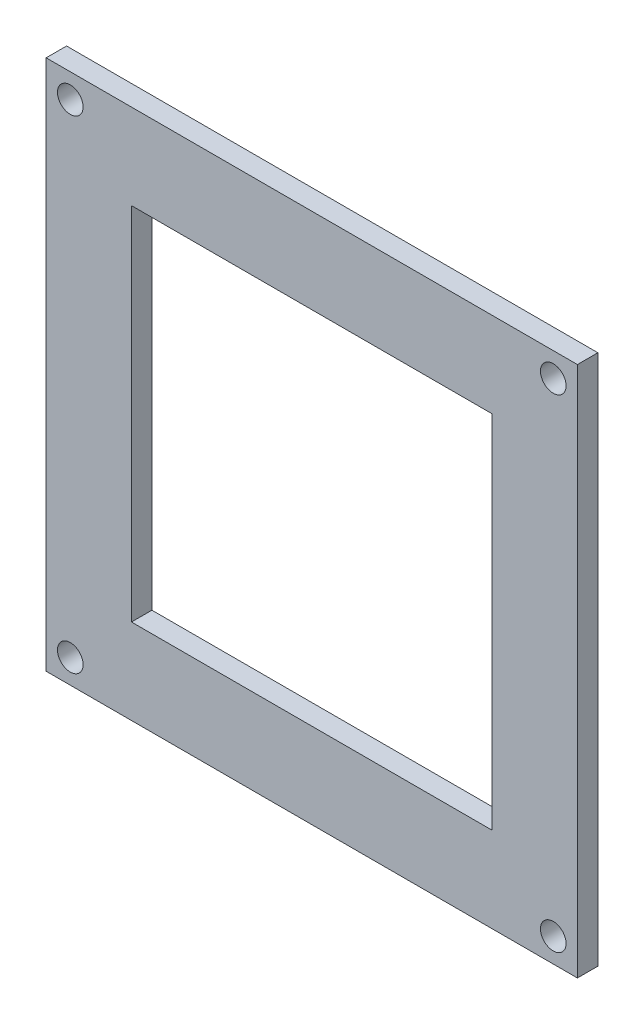
from build123d import *

# Parameters (mm, degrees)
SKETCH1_W           = 66
SKETCH1_H           = 66
SKETCH1_R           = 1.59
SKETCH1_W_2         = 44.8
SKETCH1_H_2         = 44.8
BOSS_EXTRUDE1_DEPTH = 2.54


with BuildPart() as part:
    # Sketch1 → Boss-Extrude1 (new body)
    with BuildSketch(Plane.XY):
        Rectangle(SKETCH1_W, SKETCH1_H)
        with Locations((30, 30)):
            Circle(SKETCH1_R, mode=Mode.SUBTRACT)
        with Locations((-30, 30)):
            Circle(SKETCH1_R, mode=Mode.SUBTRACT)
        with Locations((-30, -30)):
            Circle(SKETCH1_R, mode=Mode.SUBTRACT)
        with Locations((30, -30)):
            Circle(SKETCH1_R, mode=Mode.SUBTRACT)
        Rectangle(SKETCH1_W_2, SKETCH1_H_2, mode=Mode.SUBTRACT)
    extrude(amount=BOSS_EXTRUDE1_DEPTH)


solid = part.part
